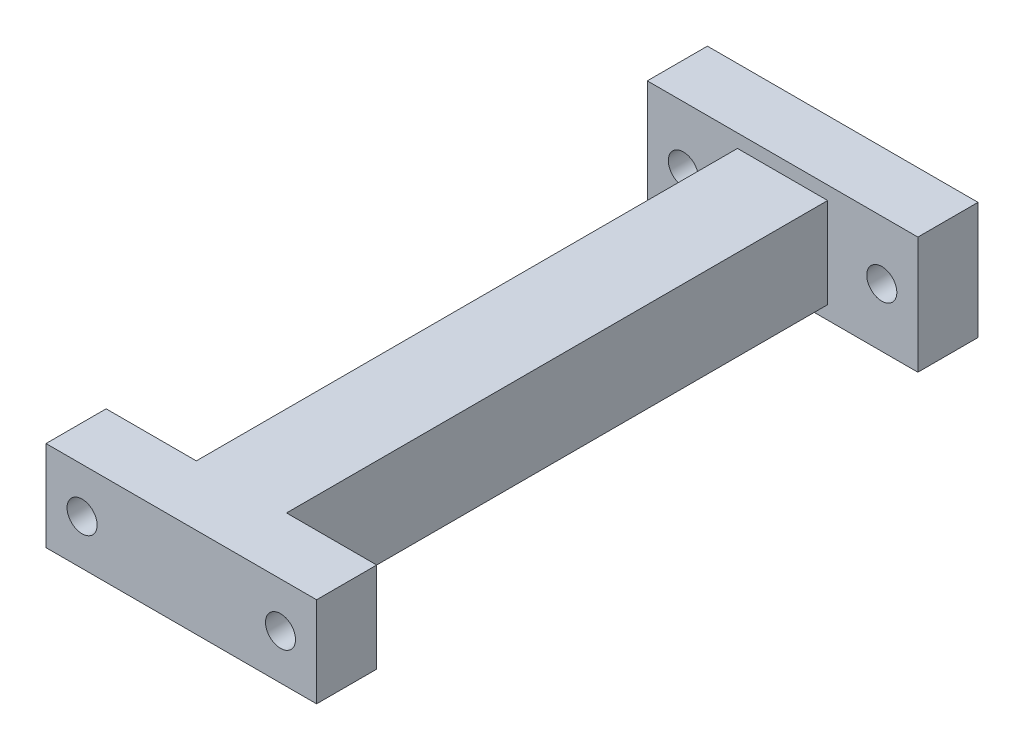
from build123d import *

# Parameters (mm, degrees)
SKETCH_1_W          = 15
SKETCH_1_H          = 15
EXTRUDE_1_DEPTH     = 110
SKETCH_2_W          = 45
SKETCH_2_H          = 15
EXTRUDE_2_DEPTH     = 10
SKETCH_3_R          = 2.5
CUT_EXTRUDE_1_DEPTH = 20
SKETCH_5_W          = 45
SKETCH_5_H          = 19.472765692
EXTRUDE_3_DEPTH     = 10
SKETCH_6_R          = 2.5
CUT_EXTRUDE_2_DEPTH = 113.698922581


with BuildPart() as part:
    # 草图1 → 凸台-拉伸1 (new body)
    with BuildSketch(Plane.XY):
        Rectangle(SKETCH_1_W, SKETCH_1_H)
    extrude(amount=EXTRUDE_1_DEPTH)

    # 草图2 → 凸台-拉伸2 (add)
    with BuildSketch(Plane.XY.offset(110)):
        Rectangle(SKETCH_2_W, SKETCH_2_H)
    extrude(amount=-EXTRUDE_2_DEPTH)

    # 草图3 → 切除-拉伸1 (cut)
    with BuildSketch(Plane.XY.offset(110)):
        with Locations((-16.5, 0)):
            Circle(SKETCH_3_R)
        with Locations((16.5, 0)):
            Circle(SKETCH_3_R)
    extrude(amount=-CUT_EXTRUDE_1_DEPTH, mode=Mode.SUBTRACT)

    # 草图5 → 凸台-拉伸3 (add)
    with BuildSketch(Plane(origin=(0, 0, 0), x_dir=(-1, 0, 0), z_dir=(0, 0, -1))):
        Rectangle(SKETCH_5_W, SKETCH_5_H)
    extrude(amount=-EXTRUDE_3_DEPTH)

    # 草图6 → 切除-拉伸2 (cut, through all)
    with BuildSketch(Plane(origin=(0, 0, 0), x_dir=(-1, 0, 0), z_dir=(0, 0, -1))):
        with Locations(Location((-16.5, 0, 0), (0, 0, 180))):
            Circle(SKETCH_6_R)
        with Locations(Location((16.5, 0, 0), (0, 0, 180))):
            Circle(SKETCH_6_R)
    extrude(amount=-CUT_EXTRUDE_2_DEPTH, mode=Mode.SUBTRACT)


solid = part.part
